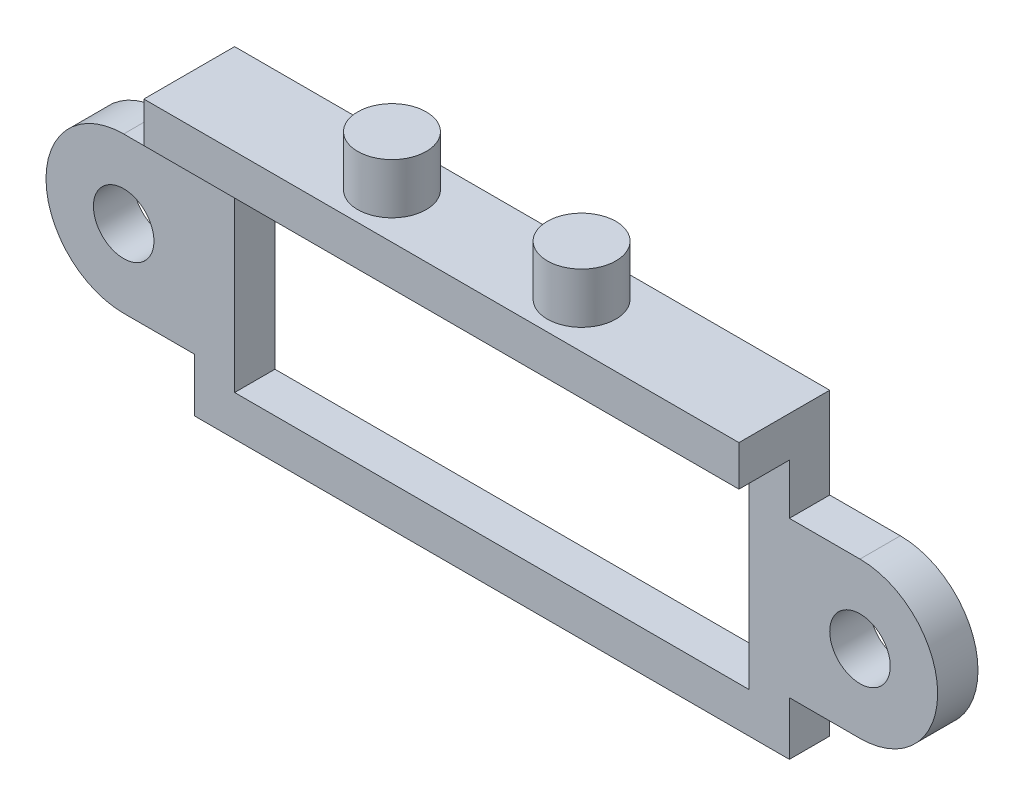
from build123d import *

# Parameters (mm, degrees)
SKETCH1_R           = 1.5
SKETCH1_W           = 25.5
SKETCH1_H           = 10.85
BOSS_EXTRUDE1_DEPTH = 2
SKETCH2_W           = 29.5
SKETCH2_H           = 2
BOSS_EXTRUDE2_DEPTH = 2.5
SKETCH3_R           = 1.7
BOSS_EXTRUDE3_DEPTH = 2.5


with BuildPart() as part:
    # Sketch1 → Boss-Extrude1 (new body)
    with BuildSketch(Plane.XY):
        with BuildLine():
            Line((-14.75, 5.675), (-14.75, 1.175))
            Line((-14.75, 1.175), (-18.25, 1.175))
            ThreePointArc((-18.25, 1.175), (-22.1, -2.675), (-18.25, -6.525))
            Line((-18.25, -6.525), (-14.75, -6.525))
            Line((-14.75, -6.525), (-14.75, -9.175))
            Line((-14.75, -9.175), (14.75, -9.175))
            Line((14.75, -9.175), (14.75, -6.525))
            Line((14.75, -6.525), (18.25, -6.525))
            ThreePointArc((18.25, -6.525), (22.1, -2.675), (18.25, 1.175))
            Line((18.25, 1.175), (14.75, 1.175))
            Line((14.75, 1.175), (14.75, 5.675))
            Line((14.75, 5.675), (-14.75, 5.675))
        make_face()
        with Locations((-18.25, -2.675)):
            Circle(SKETCH1_R, mode=Mode.SUBTRACT)
        with Locations(Location((18.25, -2.675, 0), (0, 0, 180))):
            Circle(SKETCH1_R, mode=Mode.SUBTRACT)
        with Locations((0, -1.75)):
            Rectangle(SKETCH1_W, SKETCH1_H, mode=Mode.SUBTRACT)
    extrude(amount=BOSS_EXTRUDE1_DEPTH)

    # Sketch2 → Boss-Extrude2 (add)
    with BuildSketch(Plane.XY.offset(2)):
        with Locations((0, 4.675)):
            Rectangle(SKETCH2_W, SKETCH2_H)
    extrude(amount=BOSS_EXTRUDE2_DEPTH)

    # Sketch3 → Boss-Extrude3 (add)
    with BuildSketch(Plane(origin=(0, 5.675, 0), x_dir=(1, 0, 0), z_dir=(0, 1, 0))):
        with Locations((-4.7, -2.25)):
            Circle(SKETCH3_R)
        with Locations((4.7, -2.25)):
            Circle(SKETCH3_R)
    extrude(amount=BOSS_EXTRUDE3_DEPTH)


solid = part.part
